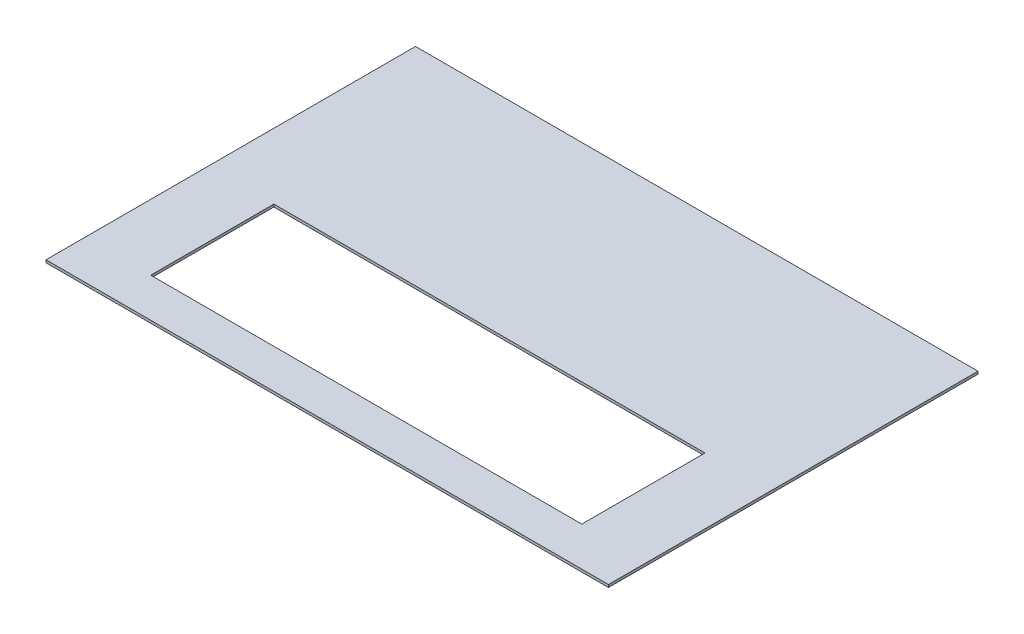
from build123d import *

# Parameters (mm, degrees)
SKETCH1_W           = 1370
SKETCH1_H           = 900
BOSS_EXTRUDE1_DEPTH = 6.35
CUT_EXTRUDE1_REACH  = 1641.189
SKETCH2_W           = 1050
SKETCH2_H           = 300


with BuildPart() as part:
    # Sketch1 → Boss-Extrude1 (new body)
    with BuildSketch(Plane(origin=(0, 0, 0), x_dir=(1, 0, 0), z_dir=(0, 1, 0))):
        with Locations((685, 450)):
            Rectangle(SKETCH1_W, SKETCH1_H)
    extrude(amount=BOSS_EXTRUDE1_DEPTH)

    # Sketch2 → Cut-Extrude1 (cut, up to next)
    with BuildSketch(Plane(origin=(0, 6.35, 0), x_dir=(1, 0, 0), z_dir=(0, 1, 0)), mode=Mode.PRIVATE) as cut_extrude1_sk1:
        with Locations((685, 245)):
            Rectangle(SKETCH2_W, SKETCH2_H)
    cut_extrude1_tool1 = extrude(cut_extrude1_sk1.sketch, amount=-CUT_EXTRUDE1_REACH, mode=Mode.PRIVATE) & part.part
    add(cut_extrude1_tool1.solids().sort_by_distance((685, 6.35, -245))[0], mode=Mode.SUBTRACT)


solid = part.part
